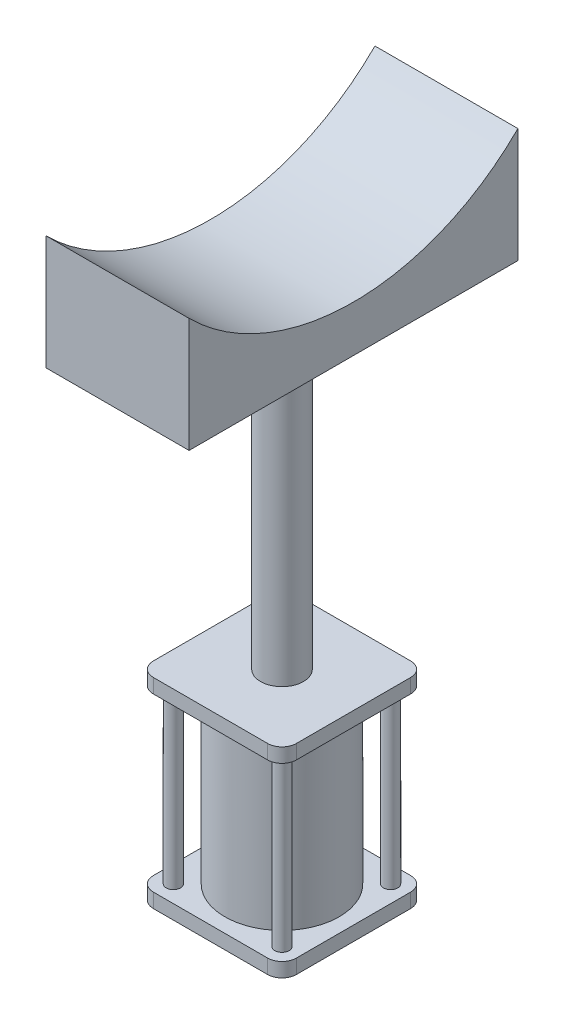
from build123d import *

# Parameters (mm, degrees)
SKETCH1_W                = 100
SKETCH1_H                = 100
BOSS_EXTRUDE1_DEPTH      = 10
SKETCH2_R                = 40
BOSS_EXTRUDE2_DEPTH      = 120
SKETCH3_W                = 100
SKETCH3_H                = 100
BOSS_EXTRUDE3_DEPTH      = 10
SKETCH4_R                = 15
BOSS_EXTRUDE4_DEPTH      = 215
SKETCH5_R                = 5
BOSS_EXTRUDE5_DEPTH      = 120
FILLET1_R                = 10
BOSS_EXTRUDE6_DEPTH      = 50
BOSS_EXTRUDE6_DEPTH_BACK = 50


with BuildPart() as part:
    # Sketch1 → Boss-Extrude1 (new body)
    with BuildSketch(Plane(origin=(0, 0, 0), x_dir=(1, 0, 0), z_dir=(0, 1, 0))):
        Rectangle(SKETCH1_W, SKETCH1_H)
    extrude(amount=BOSS_EXTRUDE1_DEPTH)



with BuildPart() as body_2:
    # Sketch2 → Boss-Extrude2 (new body)
    with BuildSketch(Plane(origin=(0, 10, 0), x_dir=(1, 0, 0), z_dir=(0, 1, 0))):
        with Locations(Location((0, 0, 0), (0, 0, 270))):
            Circle(SKETCH2_R)
    extrude(amount=BOSS_EXTRUDE2_DEPTH)


with BuildPart() as body_3:
    # Sketch3 → Boss-Extrude3 (new body)
    with BuildSketch(Plane(origin=(0, 130, 0), x_dir=(1, 0, 0), z_dir=(0, 1, 0))):
        Rectangle(SKETCH3_W, SKETCH3_H)
    extrude(amount=BOSS_EXTRUDE3_DEPTH)


with BuildPart() as body_4:
    # Sketch4 → Boss-Extrude4 (new body)
    with BuildSketch(Plane(origin=(0, 140, 0), x_dir=(1, 0, 0), z_dir=(0, 1, 0))):
        with Locations(Location((0, 0, 0), (0, 0, 270))):
            Circle(SKETCH4_R)
    extrude(amount=BOSS_EXTRUDE4_DEPTH)

    # Sketch6 → Boss-Extrude6 (add, two sides: drawn at the far end of the back side and taken through both)
    with BuildSketch(Plane(origin=(0, 0, 0), x_dir=(0, 0, -1), z_dir=(1, 0, 0)).offset(-BOSS_EXTRUDE6_DEPTH_BACK)):
        with BuildLine():
            Line((-115, 435), (-115, 355))
            Line((-115, 355), (115, 355))
            Line((115, 355), (115, 435))
            ThreePointArc((115, 435), (0, 387.365440327), (-115, 435))
        make_face()
    extrude(amount=BOSS_EXTRUDE6_DEPTH + BOSS_EXTRUDE6_DEPTH_BACK)


with BuildPart() as part_1:
    add(part.part)

    add(body_2.part)  # Boss-Extrude5 merges body 2

    add(body_3.part)  # Boss-Extrude5 merges body 3
    # Sketch5 → Boss-Extrude5 (add)
    with BuildSketch(Plane(origin=(0, 10, 0), x_dir=(1, 0, 0), z_dir=(0, 1, 0))):
        with Locations(Location((-38, 38, 0), (0, 0, 90))):
            Circle(SKETCH5_R)
        with Locations(Location((38, 38, 0), (0, 0, 90))):
            Circle(SKETCH5_R)
        with Locations(Location((38, -38, 0), (0, 0, 90))):
            Circle(SKETCH5_R)
        with Locations(Location((-38, -38, 0), (0, 0, 90))):
            Circle(SKETCH5_R)
    extrude(amount=BOSS_EXTRUDE5_DEPTH)

    # Fillet1
    fillet1_edges = [part_1.edges().sort_by_distance(p)[0] for p in [
        (-50, 135, -50),
        (-50, 135, 50),
        (50, 135, 50),
        (50, 135, -50),
        (50, 5, 50),
        (-50, 5, 50),
        (-50, 5, -50),
        (50, 5, -50),
    ]]
    fillet(fillet1_edges, radius=FILLET1_R)


solid = Compound([body_4.part, part_1.part])
